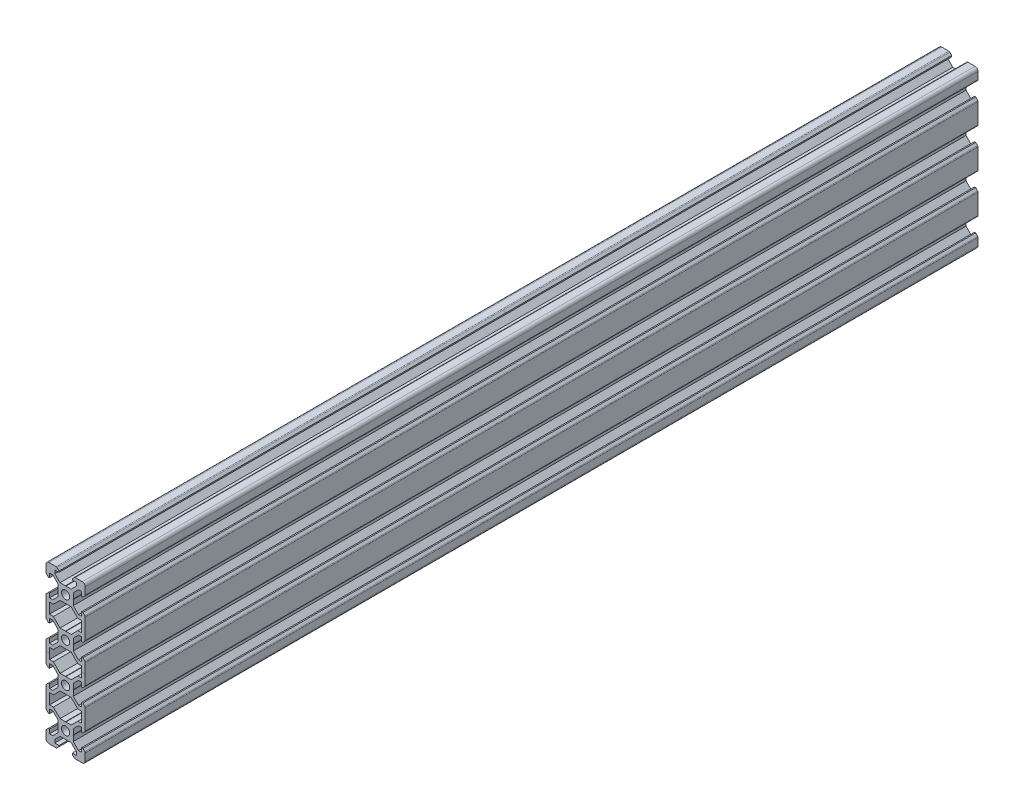
from build123d import *

# Parameters (mm, degrees)
SKETCH1_R           = 2.1
BOSS_EXTRUDE2_DEPTH = 455


with BuildPart() as part:
    # Sketch1 → Boss-Extrude2 (new body)
    with BuildSketch(Plane.XY):
        with BuildLine():
            Line((-8.5, 10), (-4.862792737, 10))
            ThreePointArc((-4.862792737, 10), (-4.598292737, 9.947387679), (-4.374060464, 9.797560464))
            Line((-4.374060464, 9.797560464), (-3.3865, 8.81))
            Line((-3.3865, 8.81), (-3.3865, 8.2))
            Line((-3.3865, 8.2), (-5.5, 8.2))
            Line((-5.5, 8.2), (-5.5, 6.561))
            Line((-5.5, 6.561), (-2.8395, 3.9005))
            Line((-2.8395, 3.9005), (-0.1, 3.9005))
            Line((-0.1, 3.9005), (0, 3.8005))
            Line((0, 3.8005), (0.1, 3.9005))
            Line((0.1, 3.9005), (2.8395, 3.9005))
            Line((2.8395, 3.9005), (5.5, 6.561))
            Line((5.5, 6.561), (5.5, 8.2))
            Line((5.5, 8.2), (3.3865, 8.2))
            Line((3.3865, 8.2), (3.3865, 8.81))
            Line((3.3865, 8.81), (4.374060464, 9.797560464))
            ThreePointArc((4.374060464, 9.797560464), (4.598292737, 9.947387679), (4.862792737, 10))
            Line((4.862792737, 10), (8.5, 10))
            ThreePointArc((8.5, 10), (9.560660172, 9.560660172), (10, 8.5))
            Line((10, 8.5), (10, 4.862792737))
            ThreePointArc((10, 4.862792737), (9.947387679, 4.598292737), (9.797560464, 4.374060464))
            Line((9.797560464, 4.374060464), (8.81, 3.3865))
            Line((8.81, 3.3865), (8.2, 3.3865))
            Line((8.2, 3.3865), (8.2, 5.5))
            Line((8.2, 5.5), (6.561, 5.5))
            Line((6.561, 5.5), (3.9005, 2.8395))
            Line((3.9005, 2.8395), (3.9005, 0.1))
            Line((3.9005, 0.1), (3.8005, 0))
            Line((3.8005, 0), (3.9005, -0.1))
            Line((3.9005, -0.1), (3.9005, -2.8395))
            Line((3.9005, -2.8395), (6.561, -5.5))
            Line((6.561, -5.5), (8.2, -5.5))
            Line((8.2, -5.5), (8.2, -3.3865))
            Line((8.2, -3.3865), (8.81, -3.3865))
            Line((8.81, -3.3865), (9.797560464, -4.374060464))
            ThreePointArc((9.797560464, -4.374060464), (9.947387679, -4.598292737), (10, -4.862792737))
            Line((10, -4.862792737), (10, -15.137207263))
            ThreePointArc((10, -15.137207263), (9.947387679, -15.401707263), (9.797560464, -15.625939536))
            Line((9.797560464, -15.625939536), (8.81, -16.6135))
            Line((8.81, -16.6135), (8.2, -16.6135))
            Line((8.2, -16.6135), (8.2, -14.5))
            Line((8.2, -14.5), (6.561, -14.5))
            Line((6.561, -14.5), (3.9005, -17.1605))
            Line((3.9005, -17.1605), (3.9005, -19.9))
            Line((3.9005, -19.9), (3.8005, -20))
            Line((3.8005, -20), (3.9005, -20.1))
            Line((3.9005, -20.1), (3.9005, -22.8395))
            Line((3.9005, -22.8395), (6.561, -25.5))
            Line((6.561, -25.5), (8.2, -25.5))
            Line((8.2, -25.5), (8.2, -23.3865))
            Line((8.2, -23.3865), (8.81, -23.3865))
            Line((8.81, -23.3865), (9.797560464, -24.374060464))
            ThreePointArc((9.797560464, -24.374060464), (9.947387679, -24.598292737), (10, -24.862792737))
            Line((10, -24.862792737), (10, -35.137207263))
            ThreePointArc((10, -35.137207263), (9.947387679, -35.401707263), (9.797560464, -35.625939536))
            Line((9.797560464, -35.625939536), (8.81, -36.6135))
            Line((8.81, -36.6135), (8.2, -36.6135))
            Line((8.2, -36.6135), (8.2, -34.5))
            Line((8.2, -34.5), (6.561, -34.5))
            Line((6.561, -34.5), (3.9005, -37.1605))
            Line((3.9005, -37.1605), (3.9005, -39.9))
            Line((3.9005, -39.9), (3.8005, -40))
            Line((3.8005, -40), (3.9005, -40.1))
            Line((3.9005, -40.1), (3.9005, -42.8395))
            Line((3.9005, -42.8395), (6.561, -45.5))
            Line((6.561, -45.5), (8.2, -45.5))
            Line((8.2, -45.5), (8.2, -43.3865))
            Line((8.2, -43.3865), (8.81, -43.3865))
            Line((8.81, -43.3865), (9.797560464, -44.374060464))
            ThreePointArc((9.797560464, -44.374060464), (9.947387679, -44.598292737), (10, -44.862792737))
            Line((10, -44.862792737), (10, -55.137207263))
            ThreePointArc((10, -55.137207263), (9.947387679, -55.401707263), (9.797560464, -55.625939536))
            Line((9.797560464, -55.625939536), (8.81, -56.6135))
            Line((8.81, -56.6135), (8.2, -56.6135))
            Line((8.2, -56.6135), (8.2, -54.5))
            Line((8.2, -54.5), (6.561, -54.5))
            Line((6.561, -54.5), (3.9005, -57.1605))
            Line((3.9005, -57.1605), (3.9005, -59.9))
            Line((3.9005, -59.9), (3.8005, -60))
            Line((3.8005, -60), (3.9005, -60.1))
            Line((3.9005, -60.1), (3.9005, -62.8395))
            Line((3.9005, -62.8395), (6.561, -65.5))
            Line((6.561, -65.5), (8.2, -65.5))
            Line((8.2, -65.5), (8.2, -63.3865))
            Line((8.2, -63.3865), (8.81, -63.3865))
            Line((8.81, -63.3865), (9.797560464, -64.374060464))
            ThreePointArc((9.797560464, -64.374060464), (9.947387679, -64.598292737), (10, -64.862792737))
            Line((10, -64.862792737), (10, -68.5))
            ThreePointArc((10, -68.5), (9.560660172, -69.560660172), (8.5, -70))
            Line((8.5, -70), (4.862792737, -70))
            ThreePointArc((4.862792737, -70), (4.598292737, -69.947387679), (4.374060464, -69.797560464))
            Line((4.374060464, -69.797560464), (3.3865, -68.81))
            Line((3.3865, -68.81), (3.3865, -68.2))
            Line((3.3865, -68.2), (5.5, -68.2))
            Line((5.5, -68.2), (5.5, -66.561))
            Line((5.5, -66.561), (2.8395, -63.9005))
            Line((2.8395, -63.9005), (0.1, -63.9005))
            Line((0.1, -63.9005), (0, -63.8005))
            Line((0, -63.8005), (-0.1, -63.9005))
            Line((-0.1, -63.9005), (-2.8395, -63.9005))
            Line((-2.8395, -63.9005), (-5.5, -66.561))
            Line((-5.5, -66.561), (-5.5, -68.2))
            Line((-5.5, -68.2), (-3.3865, -68.2))
            Line((-3.3865, -68.2), (-3.3865, -68.81))
            Line((-3.3865, -68.81), (-4.374060464, -69.797560464))
            ThreePointArc((-4.374060464, -69.797560464), (-4.598292737, -69.947387679), (-4.862792737, -70))
            Line((-4.862792737, -70), (-8.5, -70))
            ThreePointArc((-8.5, -70), (-9.560660172, -69.560660172), (-10, -68.5))
            Line((-10, -68.5), (-10, -64.862792737))
            ThreePointArc((-10, -64.862792737), (-9.947387679, -64.598292737), (-9.797560464, -64.374060464))
            Line((-9.797560464, -64.374060464), (-8.81, -63.3865))
            Line((-8.81, -63.3865), (-8.2, -63.3865))
            Line((-8.2, -63.3865), (-8.2, -65.5))
            Line((-8.2, -65.5), (-6.561, -65.5))
            Line((-6.561, -65.5), (-3.9005, -62.8395))
            Line((-3.9005, -62.8395), (-3.9005, -60.1))
            Line((-3.9005, -60.1), (-3.8005, -60))
            Line((-3.8005, -60), (-3.9005, -59.9))
            Line((-3.9005, -59.9), (-3.9005, -57.1605))
            Line((-3.9005, -57.1605), (-6.561, -54.5))
            Line((-6.561, -54.5), (-8.2, -54.5))
            Line((-8.2, -54.5), (-8.2, -56.6135))
            Line((-8.2, -56.6135), (-8.81, -56.6135))
            Line((-8.81, -56.6135), (-9.797560464, -55.625939536))
            ThreePointArc((-9.797560464, -55.625939536), (-9.947387679, -55.401707263), (-10, -55.137207263))
            Line((-10, -55.137207263), (-10, -44.862792737))
            ThreePointArc((-10, -44.862792737), (-9.947387679, -44.598292737), (-9.797560464, -44.374060464))
            Line((-9.797560464, -44.374060464), (-8.81, -43.3865))
            Line((-8.81, -43.3865), (-8.2, -43.3865))
            Line((-8.2, -43.3865), (-8.2, -45.5))
            Line((-8.2, -45.5), (-6.561, -45.5))
            Line((-6.561, -45.5), (-3.9005, -42.8395))
            Line((-3.9005, -42.8395), (-3.9005, -40.1))
            Line((-3.9005, -40.1), (-3.8005, -40))
            Line((-3.8005, -40), (-3.9005, -39.9))
            Line((-3.9005, -39.9), (-3.9005, -37.1605))
            Line((-3.9005, -37.1605), (-6.561, -34.5))
            Line((-6.561, -34.5), (-8.2, -34.5))
            Line((-8.2, -34.5), (-8.2, -36.6135))
            Line((-8.2, -36.6135), (-8.81, -36.6135))
            Line((-8.81, -36.6135), (-9.797560464, -35.625939536))
            ThreePointArc((-9.797560464, -35.625939536), (-9.947387679, -35.401707263), (-10, -35.137207263))
            Line((-10, -35.137207263), (-10, -24.862792737))
            ThreePointArc((-10, -24.862792737), (-9.947387679, -24.598292737), (-9.797560464, -24.374060464))
            Line((-9.797560464, -24.374060464), (-8.81, -23.3865))
            Line((-8.81, -23.3865), (-8.2, -23.3865))
            Line((-8.2, -23.3865), (-8.2, -25.5))
            Line((-8.2, -25.5), (-6.561, -25.5))
            Line((-6.561, -25.5), (-3.9005, -22.8395))
            Line((-3.9005, -22.8395), (-3.9005, -20.1))
            Line((-3.9005, -20.1), (-3.8005, -20))
            Line((-3.8005, -20), (-3.9005, -19.9))
            Line((-3.9005, -19.9), (-3.9005, -17.1605))
            Line((-3.9005, -17.1605), (-6.561, -14.5))
            Line((-6.561, -14.5), (-8.2, -14.5))
            Line((-8.2, -14.5), (-8.2, -16.6135))
            Line((-8.2, -16.6135), (-8.81, -16.6135))
            Line((-8.81, -16.6135), (-9.797560464, -15.625939536))
            ThreePointArc((-9.797560464, -15.625939536), (-9.947387679, -15.401707263), (-10, -15.137207263))
            Line((-10, -15.137207263), (-10, -4.862792737))
            ThreePointArc((-10, -4.862792737), (-9.947387679, -4.598292737), (-9.797560464, -4.374060464))
            Line((-9.797560464, -4.374060464), (-8.81, -3.3865))
            Line((-8.81, -3.3865), (-8.2, -3.3865))
            Line((-8.2, -3.3865), (-8.2, -5.5))
            Line((-8.2, -5.5), (-6.561, -5.5))
            Line((-6.561, -5.5), (-3.9005, -2.8395))
            Line((-3.9005, -2.8395), (-3.9005, -0.1))
            Line((-3.9005, -0.1), (-3.8005, 0))
            Line((-3.8005, 0), (-3.9005, 0.1))
            Line((-3.9005, 0.1), (-3.9005, 2.8395))
            Line((-3.9005, 2.8395), (-6.561, 5.5))
            Line((-6.561, 5.5), (-8.2, 5.5))
            Line((-8.2, 5.5), (-8.2, 3.3865))
            Line((-8.2, 3.3865), (-8.81, 3.3865))
            Line((-8.81, 3.3865), (-9.797560464, 4.374060464))
            ThreePointArc((-9.797560464, 4.374060464), (-9.947387679, 4.598292737), (-10, 4.862792737))
            Line((-10, 4.862792737), (-10, 8.5))
            ThreePointArc((-10, 8.5), (-9.560660172, 9.560660172), (-8.5, 10))
        make_face()
        with Locations(Location((0, 0, 0), (0, 0, 180))):
            Circle(SKETCH1_R, mode=Mode.SUBTRACT)
        with Locations(Location((0, -20, 0), (0, 0, 180))):
            Circle(SKETCH1_R, mode=Mode.SUBTRACT)
        with Locations(Location((0, -40, 0), (0, 0, 180))):
            Circle(SKETCH1_R, mode=Mode.SUBTRACT)
        with Locations(Location((0, -60, 0), (0, 0, 180))):
            Circle(SKETCH1_R, mode=Mode.SUBTRACT)
        Polygon((-8.2, -12.7), (-8.2, -7.3), (-6.239, -7.3), (-5.5, -6.561), (-2.8395, -3.9005), (-0.1, -3.9005), (0, -3.8005), (0.1, -3.9005), (2.8395, -3.9005), (5.5, -6.561), (6.239, -7.3), (8.2, -7.3), (8.2, -12.7), (6.239, -12.7), (5.5, -13.439), (2.8395, -16.0995), (0.1, -16.0995), (0, -16.1995), (-0.1, -16.0995), (-2.8395, -16.0995), (-5.5, -13.439), (-6.239, -12.7), align=None, mode=Mode.SUBTRACT)
        Polygon((2.8395, -23.9005), (5.5, -26.561), (6.239, -27.3), (8.2, -27.3), (8.2, -32.7), (6.239, -32.7), (5.5, -33.439), (2.8395, -36.0995), (0.1, -36.0995), (0, -36.1995), (-0.1, -36.0995), (-2.8395, -36.0995), (-5.5, -33.439), (-6.239, -32.7), (-8.2, -32.7), (-8.2, -27.3), (-6.239, -27.3), (-5.5, -26.561), (-2.8395, -23.9005), (-0.1, -23.9005), (0, -23.8005), (0.1, -23.9005), align=None, mode=Mode.SUBTRACT)
        Polygon((-0.1, -56.0995), (0, -56.1995), (0.1, -56.0995), (2.8395, -56.0995), (5.5, -53.439), (6.239, -52.7), (8.2, -52.7), (8.2, -47.3), (6.239, -47.3), (5.5, -46.561), (2.8395, -43.9005), (0.1, -43.9005), (0, -43.8005), (-0.1, -43.9005), (-2.8395, -43.9005), (-5.5, -46.561), (-6.239, -47.3), (-8.2, -47.3), (-8.2, -52.7), (-6.239, -52.7), (-5.5, -53.439), (-2.8395, -56.0995), align=None, mode=Mode.SUBTRACT)
    extrude(amount=BOSS_EXTRUDE2_DEPTH)


solid = part.part
